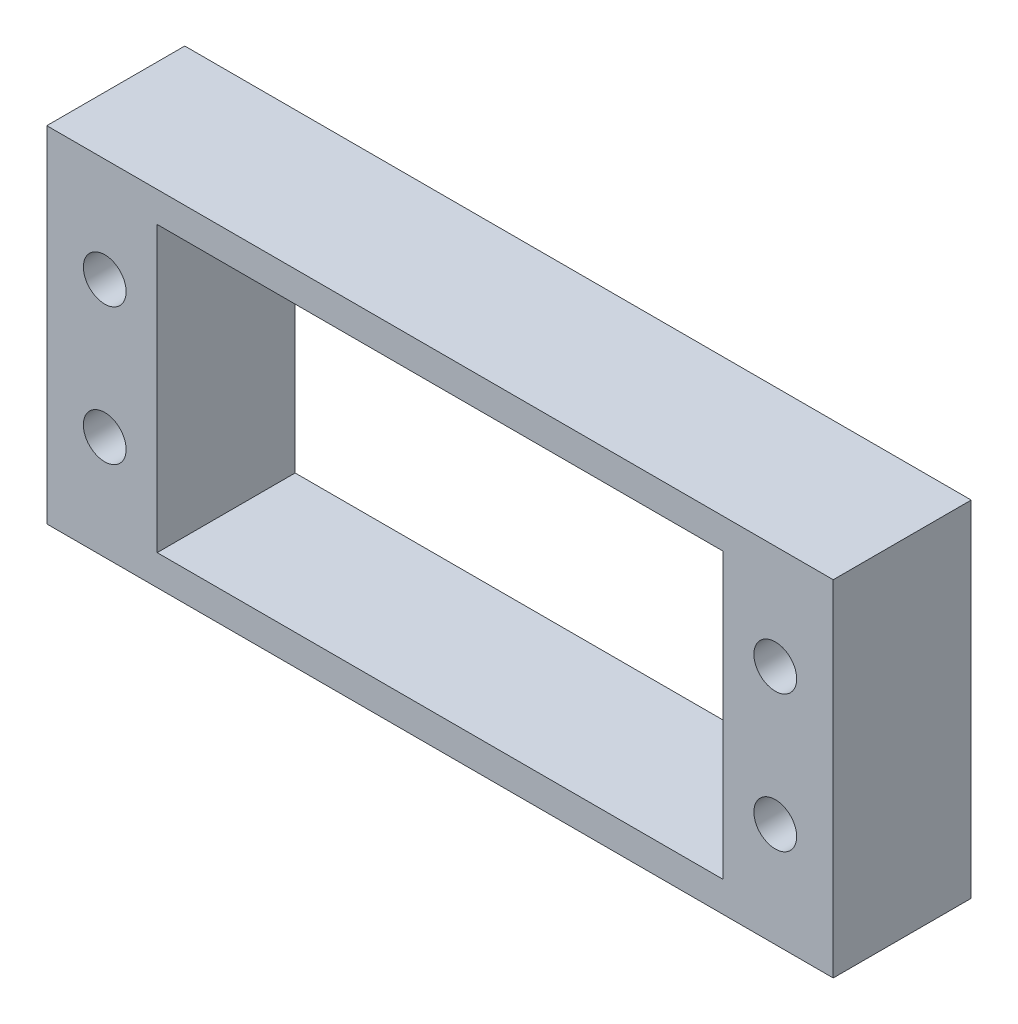
from build123d import *

# Parameters (mm, degrees)
SKETCH_1_W      = 57
SKETCH_1_H      = 25
SKETCH_1_R      = 1.55
SKETCH_1_W_2    = 41
SKETCH_1_H_2    = 20.6
EXTRUDE_1_DEPTH = 10


with BuildPart() as part:
    # 草图1 → 凸台-拉伸1 (new body)
    with BuildSketch(Plane.XY):
        Rectangle(SKETCH_1_W, SKETCH_1_H)
        with Locations((24.3, 4.95)):
            Circle(SKETCH_1_R, mode=Mode.SUBTRACT)
        with Locations(Location((-24.3, 4.95, 0), (0, 0, 180))):
            Circle(SKETCH_1_R, mode=Mode.SUBTRACT)
        with Locations((-24.3, -4.95)):
            Circle(SKETCH_1_R, mode=Mode.SUBTRACT)
        with Locations(Location((24.3, -4.95, 0), (0, 0, 180))):
            Circle(SKETCH_1_R, mode=Mode.SUBTRACT)
        Rectangle(SKETCH_1_W_2, SKETCH_1_H_2, mode=Mode.SUBTRACT)
    extrude(amount=EXTRUDE_1_DEPTH)


solid = part.part
